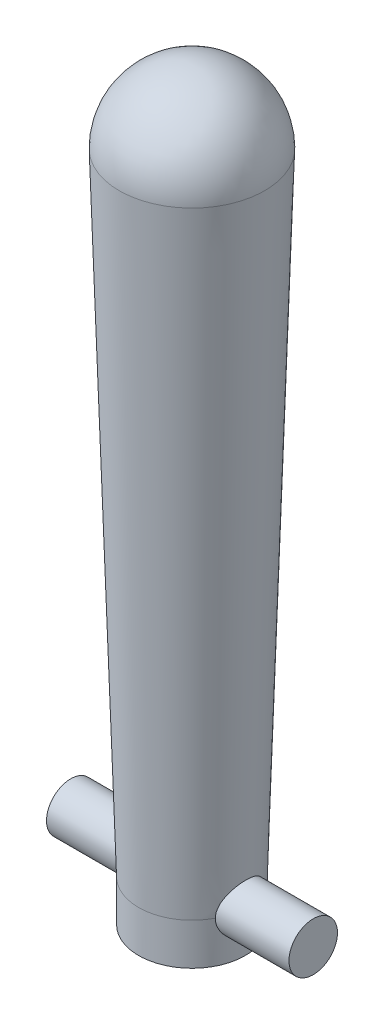
from build123d import *

# Parameters (mm, degrees)
BOSS_EXTRU_1_DEPTH      = 2.5
BOSS_EXTRU_1_DEPTH_BACK = 2.5
ESQUISSE2_R             = 0.5


with BuildPart() as part:
    # Esquisse1 → Révolution1 (revolve)
    with BuildSketch(Plane(origin=(0, 0, 0), x_dir=(0, 0, -1), z_dir=(1, 0, 0))):
        with BuildLine():
            Line((1.49716245, 12.907779617), (1.5, 13))
            ThreePointArc((1.5, 13), (1.060660172, 14.060660172), (0, 14.5))
            Line((0, 14.5), (0, -0.857830241))
            Line((0, -0.857830241), (1.1, -0.857830241))
            Line((1.1, -0.857830241), (1.1, 0))
            Line((1.1, 0), (1.49716245, 12.907779617))
        make_face()
    revolve(axis=Axis((0, 0, 0), (0, 1, 0)))

    # Esquisse2 → Boss.-Extru.1 (add, two sides: drawn at the far end of the back side and taken through both)
    with BuildSketch(Plane(origin=(0, 0, 0), x_dir=(0, 0, -1), z_dir=(1, 0, 0)).offset(-BOSS_EXTRU_1_DEPTH_BACK)):
        Circle(ESQUISSE2_R)
    extrude(amount=BOSS_EXTRU_1_DEPTH + BOSS_EXTRU_1_DEPTH_BACK)


solid = part.part
